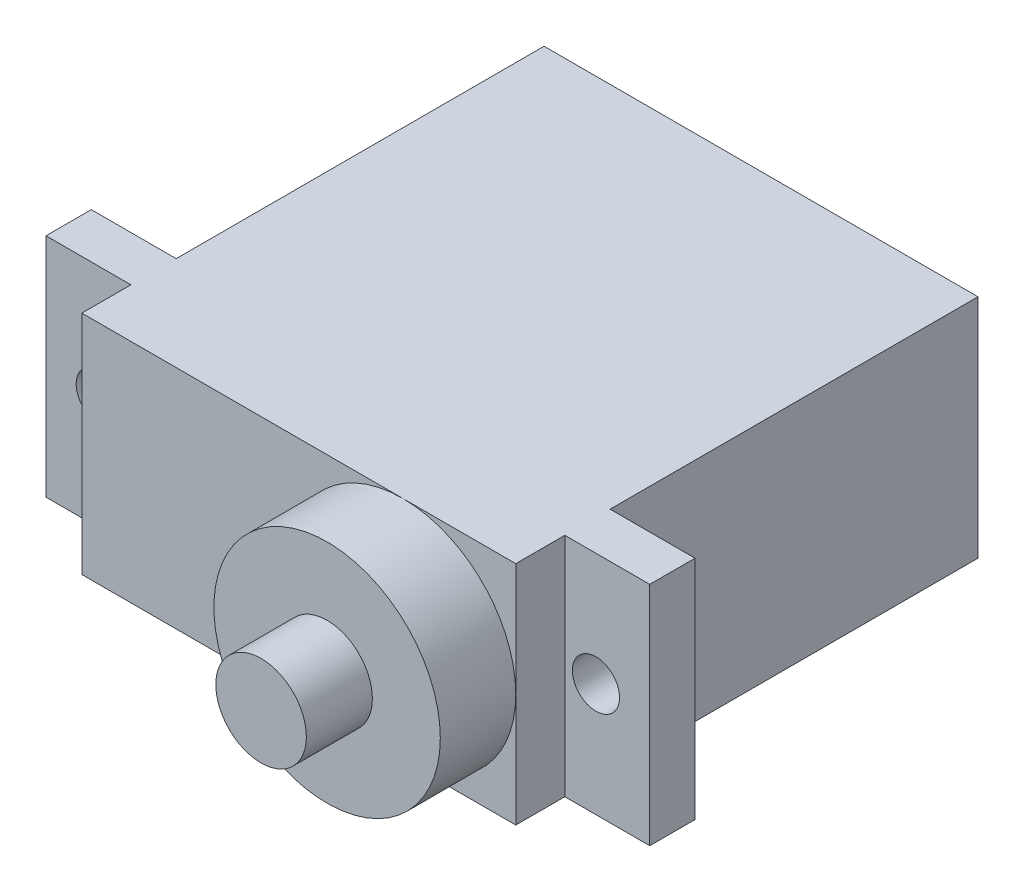
from build123d import *

# Parameters (mm, degrees)
SKETCH1_W           = 23
SKETCH1_H           = 12
BOSS_EXTRUDE1_DEPTH = 32
CUT_EXTRUDE1_DEPTH  = 7.5
SKETCH3_R           = 6
SKETCH3_R_2         = 2.4
CUT_EXTRUDE2_DEPTH  = 3.5
SKETCH4_W           = 32
SKETCH4_H           = 12
SKETCH4_R           = 1.25
BOSS_EXTRUDE2_DEPTH = 2.4


with BuildPart() as part:
    # Sketch1 → Boss-Extrude1 (new body)
    with BuildSketch(Plane.XY):
        with Locations((11.5, 6)):
            Rectangle(SKETCH1_W, SKETCH1_H)
    extrude(amount=BOSS_EXTRUDE1_DEPTH)

    # Sketch2 → Cut-Extrude1 (cut)
    with BuildSketch(Plane.XY.offset(32)):
        with BuildLine():
            Line((17, 12), (0, 12))
            Line((0, 12), (0, 0))
            Line((0, 0), (17, 0))
            ThreePointArc((17, 0), (11, 6), (17, 12))
        make_face()
        with BuildLine():
            Line((23, 12), (17, 12))
            ThreePointArc((17, 12), (21.242640687, 10.242640687), (23, 6))
            Line((23, 6), (23, 12))
        make_face()
        with BuildLine():
            ThreePointArc((23, 6), (21.242640687, 1.757359313), (17, 0))
            Line((17, 0), (23, 0))
            Line((23, 0), (23, 6))
        make_face()
    extrude(amount=-CUT_EXTRUDE1_DEPTH, mode=Mode.SUBTRACT)

    # Sketch3 → Cut-Extrude2 (cut)
    with BuildSketch(Plane.XY.offset(32)):
        with Locations((17, 6)):
            Circle(SKETCH3_R)
        with Locations((17, 6)):
            Circle(SKETCH3_R_2, mode=Mode.SUBTRACT)
    extrude(amount=-CUT_EXTRUDE2_DEPTH, mode=Mode.SUBTRACT)

    # Sketch4 → Boss-Extrude2 (add)
    with BuildSketch(Plane.XY.offset(19.5)):
        with Locations((11.5, 6)):
            Rectangle(SKETCH4_W, SKETCH4_H)
        with Locations((24.65, 6)):
            Circle(SKETCH4_R, mode=Mode.SUBTRACT)
        with Locations((-1.65, 6)):
            Circle(SKETCH4_R, mode=Mode.SUBTRACT)
    extrude(amount=BOSS_EXTRUDE2_DEPTH)


solid = part.part
